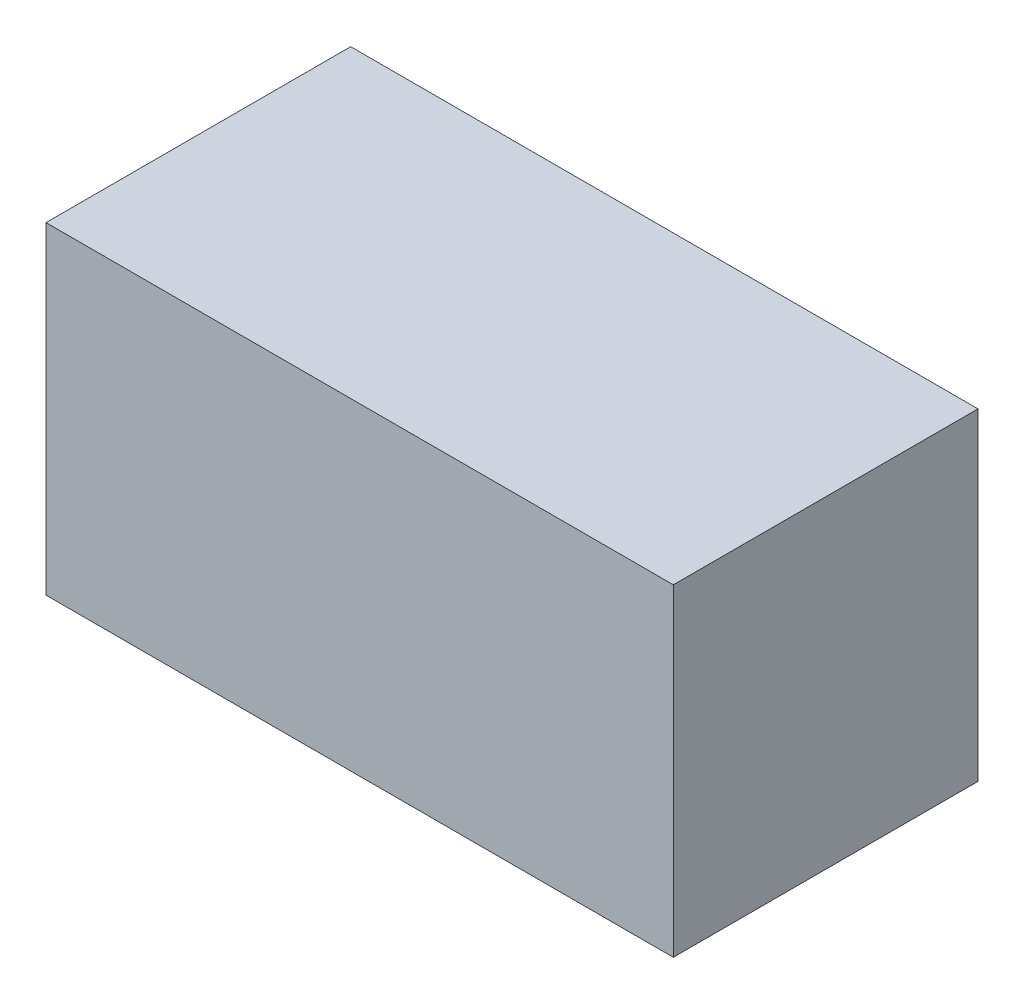
from build123d import *

# Parameters (mm, degrees)
SKETCH_1_W      = 70
SKETCH_1_H      = 36
EXTRUDE_1_DEPTH = 34


with BuildPart() as part:
    # 草图1 → 凸台-拉伸1 (new body)
    with BuildSketch(Plane.XY):
        Rectangle(SKETCH_1_W, SKETCH_1_H)
    extrude(amount=EXTRUDE_1_DEPTH)


solid = part.part
